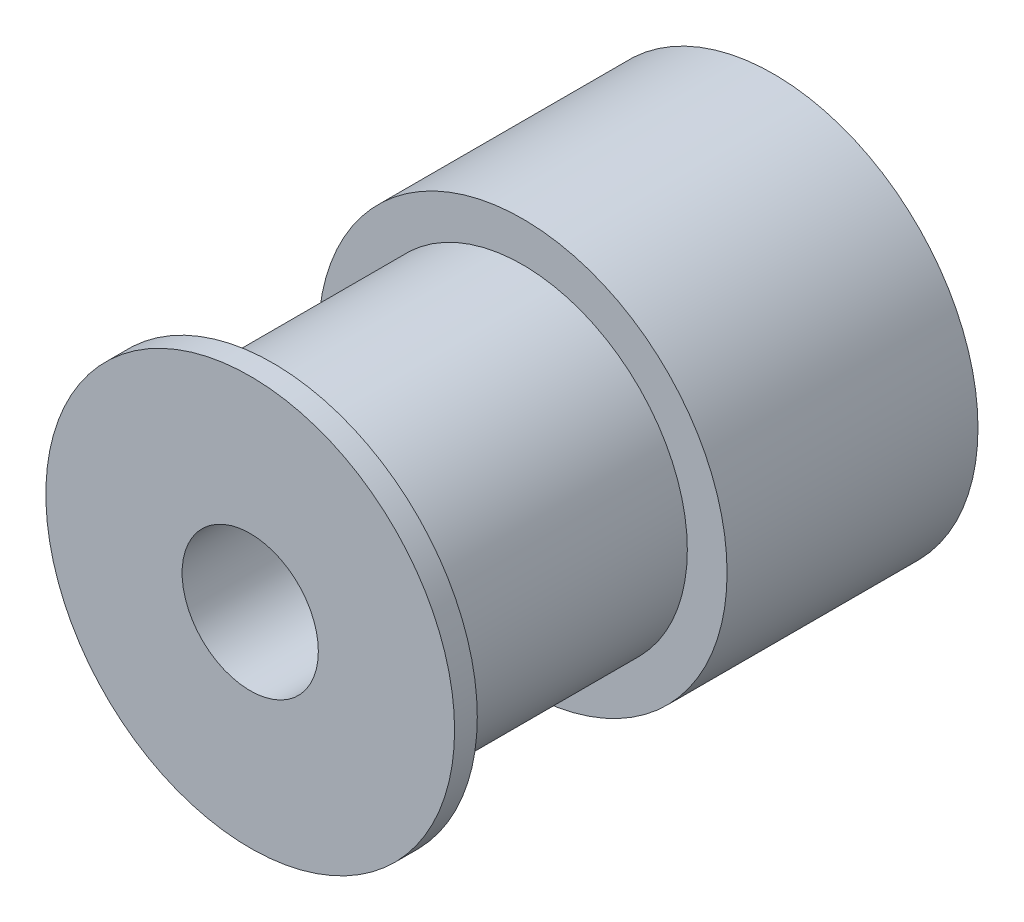
from build123d import *

# Parameters (mm, degrees)
SKETCH1_R           = 9
SKETCH1_R_2         = 3
BOSS_EXTRUDE1_DEPTH = 11.05
SKETCH2_R           = 7.25
SKETCH2_R_2         = 3
BOSS_EXTRUDE2_DEPTH = 11
SKETCH3_R           = 9
SKETCH3_R_2         = 3
BOSS_EXTRUDE3_DEPTH = 1
SKETCH4_R           = 1.5
CUT_EXTRUDE1_DEPTH  = 27.330638048
ECHELLE1_SCALE      = 2
ECHELLE2_SCALE      = 0.25


with BuildPart() as part:
    # Sketch1 → Boss-Extrude1 (new body)
    with BuildSketch(Plane.XY):
        Circle(SKETCH1_R)
        Circle(SKETCH1_R_2, mode=Mode.SUBTRACT)
    extrude(amount=BOSS_EXTRUDE1_DEPTH)

    # Sketch2 → Boss-Extrude2 (add)
    with BuildSketch(Plane.XY.offset(11.05)):
        Circle(SKETCH2_R)
        Circle(SKETCH2_R_2, mode=Mode.SUBTRACT)
    extrude(amount=BOSS_EXTRUDE2_DEPTH)

    # Sketch3 → Boss-Extrude3 (add)
    with BuildSketch(Plane.XY.offset(22.05)):
        Circle(SKETCH3_R)
        Circle(SKETCH3_R_2, mode=Mode.SUBTRACT)
    extrude(amount=BOSS_EXTRUDE3_DEPTH)

    # Sketch4 → Cut-Extrude1 (cut, through all)
    with BuildSketch(Plane(origin=(0, 0, 0), x_dir=(1, 0, 0), z_dir=(0, 1, 0))):
        with Locations(Location((0, -4, 0), (0, 0, 270))):
            Circle(SKETCH4_R)
    extrude(amount=-CUT_EXTRUDE1_DEPTH, mode=Mode.SUBTRACT)


with BuildPart() as part_1:
    # Echelle1: scaled about (3.613e-06, 0.060757241, 10.422968187)
    add(part.part.scale(ECHELLE1_SCALE).moved(Location((-3.613e-06, -0.060757241, -10.422968187))))


with BuildPart() as part_2:
    # Echelle2: scaled about (3.614e-06, 0.060757242, 10.422968188)
    add(part_1.part.scale(ECHELLE2_SCALE).moved(Location((2.711e-06, 0.045567932, 7.817226141))))


solid = part_2.part
